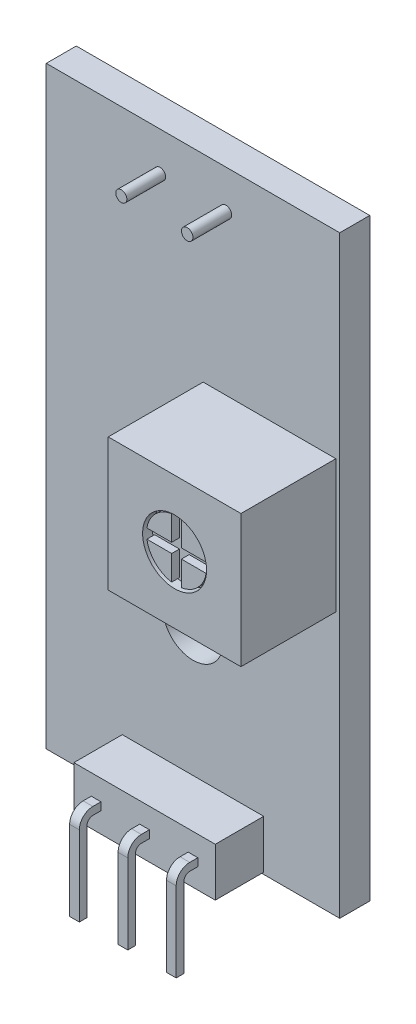
from build123d import *

# Parameters (mm, degrees)
ESBO_O1_W                = 15.15
ESBO_O1_H                = 30.65
ESBO_O1_R                = 1.55
RESSALTO_EXTRUS_O1_DEPTH = 1.55
ESBO_O2_W                = 6.85
ESBO_O2_H                = 6.85
RESSALTO_EXTRUS_O2_DEPTH = 6.45
ESBO_O3_R                = 1.65
CORTE_EXTRUS_O1_DEPTH    = 0.5
ESBO_O4_W                = 7.3
ESBO_O4_H                = 2.5
RESSALTO_EXTRUS_O3_DEPTH = 4.05
RESSALTO_EXTRUS_O5_DEPTH = 7.398508
ESBO_O12_W               = 1.34798559
ESBO_O12_H               = 5.991047065
ESBO_O12_W_2             = 0.998507844
ESBO_O12_W_3             = 2
CORTE_EXTRUS_O2_DEPTH    = 10
ESBO_O9_R                = 1.55
CORTE_EXTRUS_O3_DEPTH    = 0.1
ESBO_O15_R               = 0.297205441
ESBO_O15_R_2             = 0.285630525
RESSALTO_EXTRUS_O6_DEPTH = 2


with BuildPart() as part:
    # Esboço1 → Ressalto-extrusão1 (new body)
    with BuildSketch(Plane.XY):
        Rectangle(ESBO_O1_W, ESBO_O1_H)
        with Locations(Location((0, -6.025, 0), (0, 0, 180))):
            Circle(ESBO_O1_R, mode=Mode.SUBTRACT)
    extrude(amount=RESSALTO_EXTRUS_O1_DEPTH)

    # Esboço2 → Ressalto-extrusão2 (add)
    with BuildSketch(Plane.XY):
        with Locations((3.95, 1.7)):
            Rectangle(ESBO_O2_W, ESBO_O2_H)
    extrude(amount=RESSALTO_EXTRUS_O2_DEPTH)

    # Esboço3 → Corte-extrusão1 (cut)
    with BuildSketch(Plane.XY.offset(6.45)):
        with Locations((3.95, 1.7)):
            Circle(ESBO_O3_R)
        with BuildLine():
            Line((3.7, 1.95), (2.420294146, 1.95))
            ThreePointArc((2.420294146, 1.95), (2.853984489, 2.796015511), (3.7, 3.229705854))
            Line((3.7, 3.229705854), (3.7, 1.95))
        make_face(mode=Mode.SUBTRACT)
        with BuildLine():
            Line((5.479705854, 1.45), (4.2, 1.45))
            Line((4.2, 1.45), (4.2, 0.170294146))
            ThreePointArc((4.2, 0.170294146), (5.046015511, 0.603984489), (5.479705854, 1.45))
        make_face(mode=Mode.SUBTRACT)
        with BuildLine():
            Line((5.479705854, 1.95), (4.2, 1.95))
            Line((4.2, 1.95), (4.2, 3.229705854))
            ThreePointArc((4.2, 3.229705854), (5.046015511, 2.796015511), (5.479705854, 1.95))
        make_face(mode=Mode.SUBTRACT)
        with BuildLine():
            Line((3.7, 1.45), (3.7, 0.170294146))
            ThreePointArc((3.7, 0.170294146), (2.853984489, 0.603984489), (2.420294146, 1.45))
            Line((2.420294146, 1.45), (3.7, 1.45))
        make_face(mode=Mode.SUBTRACT)
    extrude(amount=-CORTE_EXTRUS_O1_DEPTH, mode=Mode.SUBTRACT)

    # Esboço4 → Ressalto-extrusão3 (add)
    with BuildSketch(Plane.XY):
        with Locations((0, -13.975)):
            Rectangle(ESBO_O4_W, ESBO_O4_H)
    extrude(amount=RESSALTO_EXTRUS_O3_DEPTH)

    # Esboço11 → Ressalto-extrusão5 (add)
    with BuildSketch(Plane.ZY.offset(3.65)):
        with BuildLine():
            Line((4.05, -14.175), (4.467357012, -14.175))
            ThreePointArc((4.467357012, -14.175), (4.679489046, -14.262867966), (4.767357012, -14.475))
            Line((4.767357012, -14.475), (4.767357012, -18.595051461))
            Line((4.767357012, -18.595051461), (5.167357012, -18.595051461))
            Line((5.167357012, -18.595051461), (5.167357012, -14.475))
            ThreePointArc((5.167357012, -14.475), (4.962331759, -13.980025253), (4.467357012, -13.775))
            Line((4.467357012, -13.775), (4.05, -13.775))
            Line((4.05, -13.775), (4.05, -14.175))
        make_face()
    extrude(amount=-RESSALTO_EXTRUS_O5_DEPTH)

    # Esboço12 → Corte-extrusão2 (cut)
    with BuildSketch(Plane.XY.offset(4.05)):
        with Locations((-3.423992795, -16.372351479)):
            Rectangle(ESBO_O12_W, ESBO_O12_H)
        with Locations((3.249253922, -16.372351479)):
            Rectangle(ESBO_O12_W_2, ESBO_O12_H)
        with Locations((-1.25, -16.372351479)):
            Rectangle(ESBO_O12_W_3, ESBO_O12_H)
        with Locations((1.25, -16.372351479)):
            Rectangle(ESBO_O12_W_3, ESBO_O12_H)
    extrude(amount=CORTE_EXTRUS_O2_DEPTH, mode=Mode.SUBTRACT)

    # Esboço9 → Corte-extrusão3 (cut)
    with BuildSketch(Plane.XY.offset(6.45)):
        with Locations((3.95, 1.7)):
            Circle(ESBO_O9_R)
    extrude(amount=-CORTE_EXTRUS_O3_DEPTH, mode=Mode.SUBTRACT)

    # Esboço15 → Ressalto-extrusão6 (add)
    with BuildSketch(Plane.XY.offset(1.55)):
        with Locations(Location((1.7, 13.325, 0), (0, 0, 180))):
            Circle(ESBO_O15_R)
        with Locations(Location((-1.7, 13.325, 0), (0, 0, 180))):
            Circle(ESBO_O15_R_2)
    extrude(amount=RESSALTO_EXTRUS_O6_DEPTH)


solid = part.part
